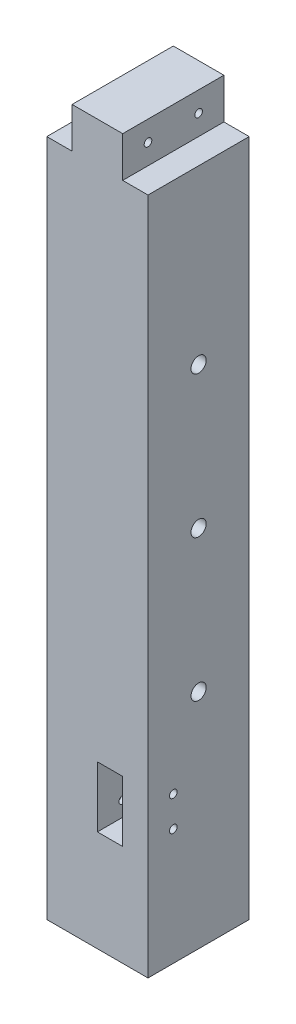
from build123d import *

# Parameters (mm, degrees)
SKETCH1_W           = 63.5
SKETCH1_H           = 50.8
BOSS_EXTRUDE1_DEPTH = 127
SKETCH2_W           = 31.75
SKETCH2_H           = 76.2
CUT_EXTRUDE1_DEPTH  = 63.5
SKETCH3_W           = 31.75
SKETCH3_H           = 76.2
CUT_EXTRUDE3_DEPTH  = 63.246
SKETCH4_R           = 9.525
CUT_EXTRUDE4_DEPTH  = 509.991220455
CUT_EXTRUDE5_DEPTH  = 69.85
CUT_EXTRUDE6_DEPTH  = 69.85
SKETCH7_R           = 4.7625
CUT_EXTRUDE7_DEPTH  = 503.011578552


with BuildPart() as part:
    # Sketch1 → Boss-Extrude1 (new body)
    with BuildSketch(Plane.XY):
        Polygon((63.5, -425.45), (63.5, 425.45), (31.75, 425.45), (31.75, 374.65), (-31.75, 374.65), (-31.75, 425.45), (-63.5, 425.45), (-63.5, -425.45), align=None)
        with Locations((0, 400.05)):
            Rectangle(SKETCH1_W, SKETCH1_H)
        with Locations((0, 450.85)):
            Rectangle(SKETCH1_W, SKETCH1_H)
    extrude(amount=BOSS_EXTRUDE1_DEPTH)

    # Sketch2 → Cut-Extrude1 (cut)
    with BuildSketch(Plane.XY.offset(127)):
        with Locations((15.875, -260.35)):
            Rectangle(SKETCH2_W, SKETCH2_H)
    extrude(amount=-CUT_EXTRUDE1_DEPTH, mode=Mode.SUBTRACT)

    # Sketch3 → Cut-Extrude3 (cut)
    with BuildSketch(Plane.ZY.offset(63.5)):
        with Locations((47.625, -260.35)):
            Rectangle(SKETCH3_W, SKETCH3_H)
    extrude(amount=-CUT_EXTRUDE3_DEPTH, mode=Mode.SUBTRACT)

    # Sketch4 → Cut-Extrude4 (cut, through all)
    with BuildSketch(Plane.ZY.offset(63.5)):
        with Locations(Location((63.5, -146.05, 0), (0, 0, 270))):
            Circle(SKETCH4_R)
        with Locations(Location((63.5, 31.75, 0), (0, 0, 270))):
            Circle(SKETCH4_R)
        with Locations(Location((63.5, 209.55, 0), (0, 0, 270))):
            Circle(SKETCH4_R)
    extrude(amount=-CUT_EXTRUDE4_DEPTH, mode=Mode.SUBTRACT)

    # Sketch5 → Cut-Extrude5 (cut)
    with BuildSketch(Plane(origin=(0, 0, 0), x_dir=(-1, 0, 0), z_dir=(0, 0, -1))):
        with BuildLine():
            ThreePointArc((36.5125, -279.4), (35.117596045, -276.032403955), (31.75, -274.6375))
            Line((31.75, -274.6375), (31.75, -284.1625))
            ThreePointArc((31.75, -284.1625), (35.117596045, -282.767596045), (36.5125, -279.4))
        make_face()
        with BuildLine():
            Line((31.75, -284.1625), (31.75, -274.6375))
            ThreePointArc((31.75, -274.6375), (26.9875, -279.4), (31.75, -284.1625))
        make_face()
        with BuildLine():
            ThreePointArc((36.5125, -241.3), (35.117596045, -237.932403955), (31.75, -236.5375))
            Line((31.75, -236.5375), (31.75, -246.0625))
            ThreePointArc((31.75, -246.0625), (35.117596045, -244.667596045), (36.5125, -241.3))
        make_face()
        with BuildLine():
            Line((31.75, -246.0625), (31.75, -236.5375))
            ThreePointArc((31.75, -236.5375), (26.9875, -241.3), (31.75, -246.0625))
        make_face()
    extrude(amount=-CUT_EXTRUDE5_DEPTH, mode=Mode.SUBTRACT)

    # Sketch6 → Cut-Extrude6 (cut)
    with BuildSketch(Plane(origin=(63.5, 0, 0), x_dir=(0, 0, -1), z_dir=(1, 0, 0))):
        with BuildLine():
            ThreePointArc((-90.4875, -241.3), (-91.882403955, -237.932403955), (-95.25, -236.5375))
            Line((-95.25, -236.5375), (-95.25, -246.0625))
            ThreePointArc((-95.25, -246.0625), (-91.882403955, -244.667596045), (-90.4875, -241.3))
        make_face()
        with BuildLine():
            Line((-95.25, -246.0625), (-95.25, -236.5375))
            ThreePointArc((-95.25, -236.5375), (-100.0125, -241.3), (-95.25, -246.0625))
        make_face()
        with BuildLine():
            ThreePointArc((-90.4875, -279.4), (-91.882403955, -276.032403955), (-95.25, -274.6375))
            Line((-95.25, -274.6375), (-95.25, -284.1625))
            ThreePointArc((-95.25, -284.1625), (-91.882403955, -282.767596045), (-90.4875, -279.4))
        make_face()
        with BuildLine():
            Line((-95.25, -284.1625), (-95.25, -274.6375))
            ThreePointArc((-95.25, -274.6375), (-100.0125, -279.4), (-95.25, -284.1625))
        make_face()
    extrude(amount=-CUT_EXTRUDE6_DEPTH, mode=Mode.SUBTRACT)

    # Sketch7 → Cut-Extrude7 (cut, through all)
    with BuildSketch(Plane(origin=(31.75, 0, 0), x_dir=(0, 0, -1), z_dir=(1, 0, 0))):
        with Locations(Location((-95.25, 450.85, 0), (0, 0, 90))):
            Circle(SKETCH7_R)
        with Locations(Location((-31.75, 450.85, 0), (0, 0, 90))):
            Circle(SKETCH7_R)
    extrude(amount=-CUT_EXTRUDE7_DEPTH, mode=Mode.SUBTRACT)


solid = part.part
